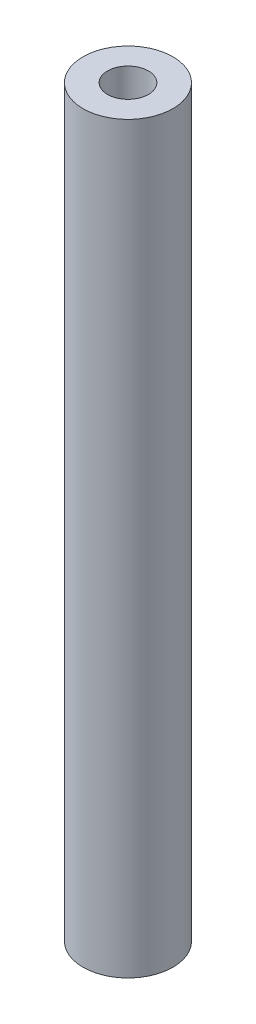
from build123d import *

# Parameters (mm, degrees)
SKETCH1_R           = 5.5
SKETCH1_R_2         = 2.5
BOSS_EXTRUDE1_DEPTH = 91


with BuildPart() as part:
    # Sketch1 → Boss-Extrude1 (new body)
    with BuildSketch(Plane(origin=(0, 0, 0), x_dir=(1, 0, 0), z_dir=(0, 1, 0))):
        with Locations(Location((0, 0, 0), (0, 0, 270))):
            Circle(SKETCH1_R)
        with Locations(Location((0, 0, 0), (0, 0, 270))):
            Circle(SKETCH1_R_2, mode=Mode.SUBTRACT)
    extrude(amount=BOSS_EXTRUDE1_DEPTH)


solid = part.part
